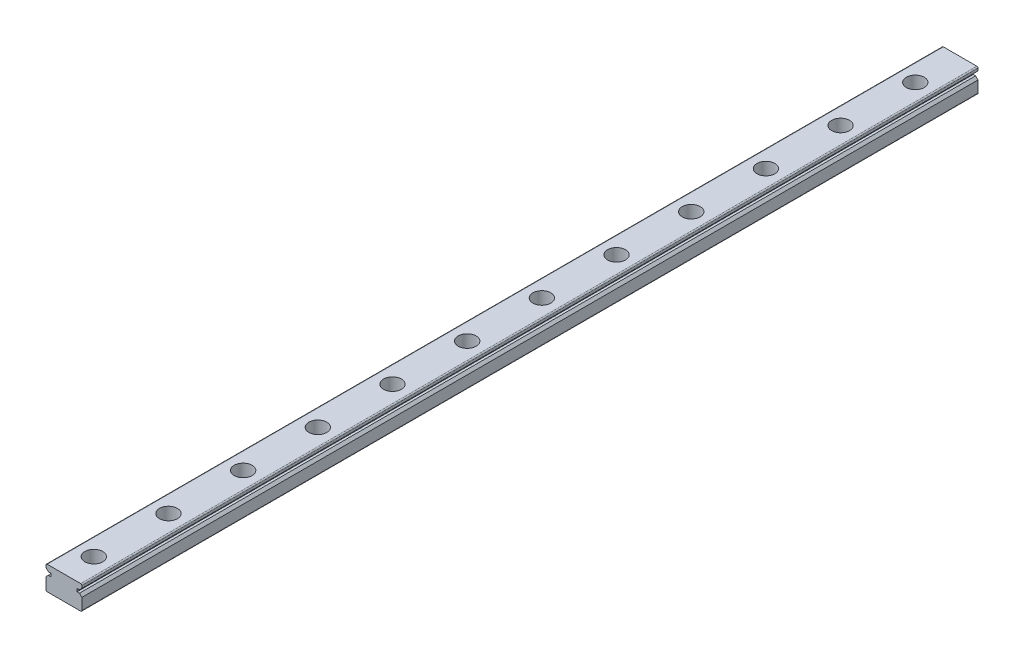
from build123d import *

# Parameters (mm, degrees)
BOSS_EXTRUDE1_DEPTH = 300
SKETCH2_R           = 3
CUT_EXTRUDE1_DEPTH  = 4.5
SKETCH3_R           = 1.75
CUT_EXTRUDE2_DEPTH  = 301.166620396


with BuildPart() as part:
    # Sketch1 → Boss-Extrude1 (new body)
    with BuildSketch(Plane.XY):
        with BuildLine():
            Line((-5.6, 4), (5.6, 4))
            ThreePointArc((5.6, 4), (5.882842712, 3.882842712), (6, 3.6))
            Line((6, 3.6), (6, 2.8))
            Line((6, 2.8), (5.2, 2))
            Line((5.2, 2), (4.4, 2))
            Line((4.4, 2), (4.4, 1))
            Line((4.4, 1), (5.2, 1))
            Line((5.2, 1), (6, 0.2))
            Line((6, 0.2), (6, -3.6))
            ThreePointArc((6, -3.6), (5.882842712, -3.882842712), (5.6, -4))
            Line((5.6, -4), (-5.6, -4))
            ThreePointArc((-5.6, -4), (-5.882842712, -3.882842712), (-6, -3.6))
            Line((-6, -3.6), (-6, 0.2))
            Line((-6, 0.2), (-5.2, 1))
            Line((-5.2, 1), (-4.4, 1))
            Line((-4.4, 1), (-4.4, 2))
            Line((-4.4, 2), (-5.2, 2))
            Line((-5.2, 2), (-6, 2.8))
            Line((-6, 2.8), (-6, 3.6))
            ThreePointArc((-6, 3.6), (-5.882842712, 3.882842712), (-5.6, 4))
        make_face()
    extrude(amount=BOSS_EXTRUDE1_DEPTH)

    # Sketch2 → Cut-Extrude1 (cut)
    with BuildSketch(Plane(origin=(0, 4, 0), x_dir=(1, 0, 0), z_dir=(0, 1, 0))):
        with Locations(Location((0, -290, 0), (0, 0, 270))):
            Circle(SKETCH2_R)
        with Locations(Location((0, -265, 0), (0, 0, 270))):
            Circle(SKETCH2_R)
        with Locations(Location((0, -240, 0), (0, 0, 270))):
            Circle(SKETCH2_R)
        with Locations(Location((0, -215, 0), (0, 0, 270))):
            Circle(SKETCH2_R)
        with Locations(Location((0, -190, 0), (0, 0, 270))):
            Circle(SKETCH2_R)
        with Locations(Location((0, -165, 0), (0, 0, 270))):
            Circle(SKETCH2_R)
        with Locations(Location((0, -140, 0), (0, 0, 270))):
            Circle(SKETCH2_R)
        with Locations(Location((0, -115, 0), (0, 0, 270))):
            Circle(SKETCH2_R)
        with Locations(Location((0, -90, 0), (0, 0, 270))):
            Circle(SKETCH2_R)
        with Locations(Location((0, -65, 0), (0, 0, 270))):
            Circle(SKETCH2_R)
        with Locations(Location((0, -40, 0), (0, 0, 270))):
            Circle(SKETCH2_R)
        with Locations(Location((0, -15, 0), (0, 0, 270))):
            Circle(SKETCH2_R)
        with Locations((0, 10)):
            Circle(SKETCH2_R)
        with Locations((0, 35)):
            Circle(SKETCH2_R)
        with Locations((0, 60)):
            Circle(SKETCH2_R)
        with Locations((0, 85)):
            Circle(SKETCH2_R)
        with Locations((0, 110)):
            Circle(SKETCH2_R)
        with Locations((0, 135)):
            Circle(SKETCH2_R)
    extrude(amount=-CUT_EXTRUDE1_DEPTH, mode=Mode.SUBTRACT)

    # Sketch3 → Cut-Extrude2 (cut, through all)
    with BuildSketch(Plane(origin=(0, 4, 0), x_dir=(1, 0, 0), z_dir=(0, 1, 0))):
        with Locations(Location((0, -290.001504258, 0), (0, 0, 270))):
            Circle(SKETCH3_R)
        with Locations(Location((0, -265.001504258, 0), (0, 0, 270))):
            Circle(SKETCH3_R)
        with Locations(Location((0, -240.001504258, 0), (0, 0, 270))):
            Circle(SKETCH3_R)
        with Locations(Location((0, -215.001504258, 0), (0, 0, 270))):
            Circle(SKETCH3_R)
        with Locations(Location((0, -190.001504258, 0), (0, 0, 270))):
            Circle(SKETCH3_R)
        with Locations(Location((0, -165.001504258, 0), (0, 0, 270))):
            Circle(SKETCH3_R)
        with Locations(Location((0, -140.001504258, 0), (0, 0, 270))):
            Circle(SKETCH3_R)
        with Locations(Location((0, -115.001504258, 0), (0, 0, 270))):
            Circle(SKETCH3_R)
        with Locations(Location((0, -90.001504258, 0), (0, 0, 270))):
            Circle(SKETCH3_R)
        with Locations(Location((0, -65.001504258, 0), (0, 0, 270))):
            Circle(SKETCH3_R)
        with Locations(Location((0, -40.001504258, 0), (0, 0, 270))):
            Circle(SKETCH3_R)
        with Locations(Location((0, -15.001504258, 0), (0, 0, 270))):
            Circle(SKETCH3_R)
        with Locations((0, 9.998495742)):
            Circle(SKETCH3_R)
        with Locations((0, 34.998495742)):
            Circle(SKETCH3_R)
        with Locations((0, 59.998495742)):
            Circle(SKETCH3_R)
    extrude(amount=-CUT_EXTRUDE2_DEPTH, mode=Mode.SUBTRACT)


solid = part.part
